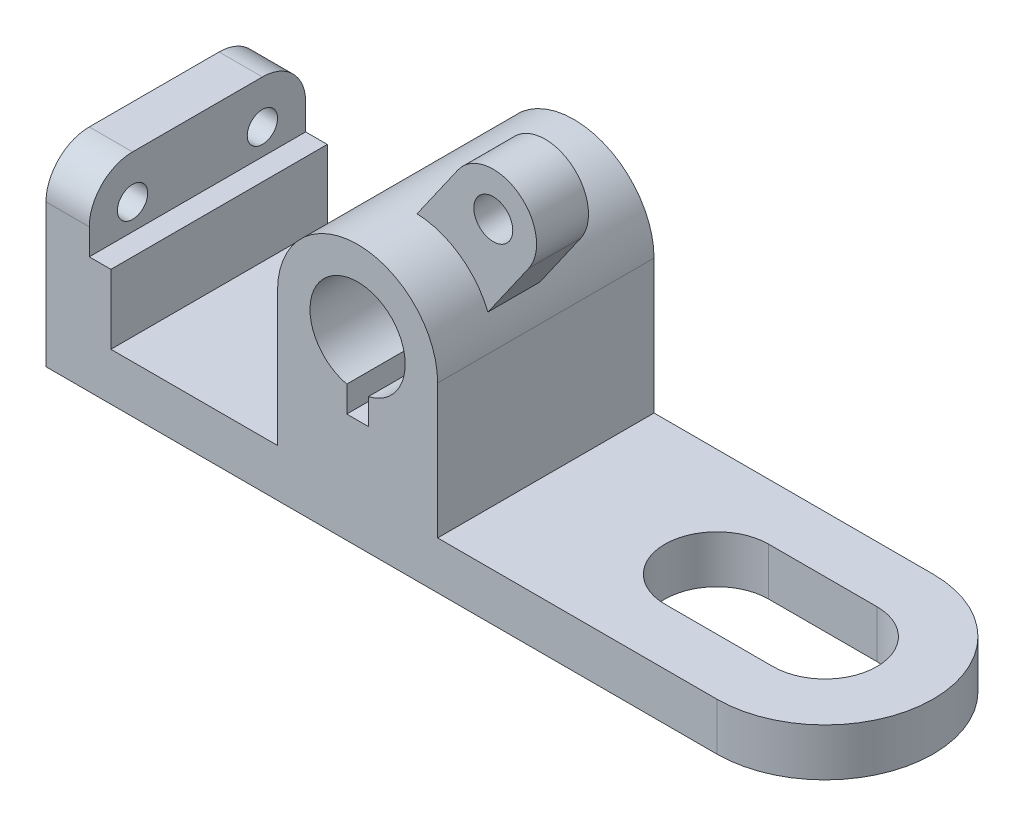
from build123d import *

# Parameters (mm, degrees)
BOSS_EXTRUDE1_DEPTH = 25
CUT_EXTRUDE1_DEPTH  = 11
BOSS_EXTRUDE2_START = 12
SKETCH1_3_R         = 4.5
BOSS_EXTRUDE2_DEPTH = 12
SKETCH3_R           = 3.5
CUT_EXTRUDE2_DEPTH  = 10


with BuildPart() as part:
    # Sketch1 → Boss-Extrude1 (new, symmetric)
    with BuildSketch(Plane.XY):
        with BuildLine():
            ThreePointArc((-101.5, 42), (-83, 60.5), (-64.5, 42))
            Line((-64.5, 42), (-64.5, 11))
            Line((-64.5, 11), (25, 11))
            Line((25, 11), (25, 0))
            Line((25, 0), (0, 0))
            Line((0, 0), (-155, 0))
            Line((-155, 0), (-155, 43))
            Line((-155, 43), (-145, 43))
            Line((-145, 43), (-145, 27))
            Line((-145, 27), (-140, 27))
            Line((-140, 27), (-140, 11))
            Line((-140, 11), (-101.5, 11))
            Line((-101.5, 11), (-101.5, 42))
        make_face()
        with BuildLine():
            ThreePointArc((-80.5, 31.287857357), (-83, 53), (-85.5, 31.287857357))
            Line((-85.5, 31.287857357), (-85.5, 25.287857357))
            Line((-85.5, 25.287857357), (-80.5, 25.287857357))
            Line((-80.5, 25.287857357), (-80.5, 31.287857357))
        make_face(mode=Mode.SUBTRACT)
    extrude(amount=BOSS_EXTRUDE1_DEPTH, both=True)

    # Sketch2 → Cut-Extrude1 (cut)
    with BuildSketch(Plane(origin=(0, 11, 0), x_dir=(1, 0, 0), z_dir=(0, 1, 0))):
        with BuildLine():
            Line((0, 12), (-25, 12))
            ThreePointArc((-25, 12), (-37, 0), (-25, -12))
            Line((-25, -12), (0, -12))
            ThreePointArc((0, -12), (12, 0), (0, 12))
        make_face()
        with BuildLine():
            Line((25, 25), (0, 25))
            ThreePointArc((0, 25), (17.677669539, 17.67766952), (25, -2.6e-08))
            Line((25, -2.6e-08), (25, 25))
        make_face()
        with BuildLine():
            Line((25, -25), (25, -2.6e-08))
            ThreePointArc((25, -2.6e-08), (17.67766952, -17.677669539), (0, -25))
            Line((0, -25), (25, -25))
        make_face()
    extrude(amount=-CUT_EXTRUDE1_DEPTH, mode=Mode.SUBTRACT)

    # Sketch1<3> → Boss-Extrude2 (add)
    with BuildSketch(Plane.XY.offset(BOSS_EXTRUDE2_START)):
        with BuildLine():
            ThreePointArc((-82.264157443, 60.485360038), (-72.388835928, 57.154312819), (-65.881116557, 49.013831311))
            Line((-65.881116557, 49.013831311), (-56.454033594, 62.477101054))
            ThreePointArc((-56.454033594, 62.477101054), (-58.909789673, 76.40438586), (-72.83707448, 73.948629781))
            Line((-72.83707448, 73.948629781), (-82.264157443, 60.485360038))
        make_face()
        with Locations((-64.645554037, 68.212865417)):
            Circle(SKETCH1_3_R, mode=Mode.SUBTRACT)
    extrude(amount=-BOSS_EXTRUDE2_DEPTH)

    # Sketch3 → Cut-Extrude2 (cut)
    with BuildSketch(Plane.ZY.offset(155)):
        with BuildLine():
            Line((-25, 43), (-25, 33))
            ThreePointArc((-25, 33), (-22.071067812, 40.071067812), (-15, 43))
            Line((-15, 43), (-25, 43))
        make_face()
        with BuildLine():
            ThreePointArc((15, 43), (22.071067812, 40.071067812), (25, 33))
            Line((25, 33), (25, 43))
            Line((25, 43), (15, 43))
        make_face()
        with Locations((-15, 33)):
            Circle(SKETCH3_R)
        with Locations((15, 33)):
            Circle(SKETCH3_R)
    extrude(amount=-CUT_EXTRUDE2_DEPTH, mode=Mode.SUBTRACT)


solid = part.part
